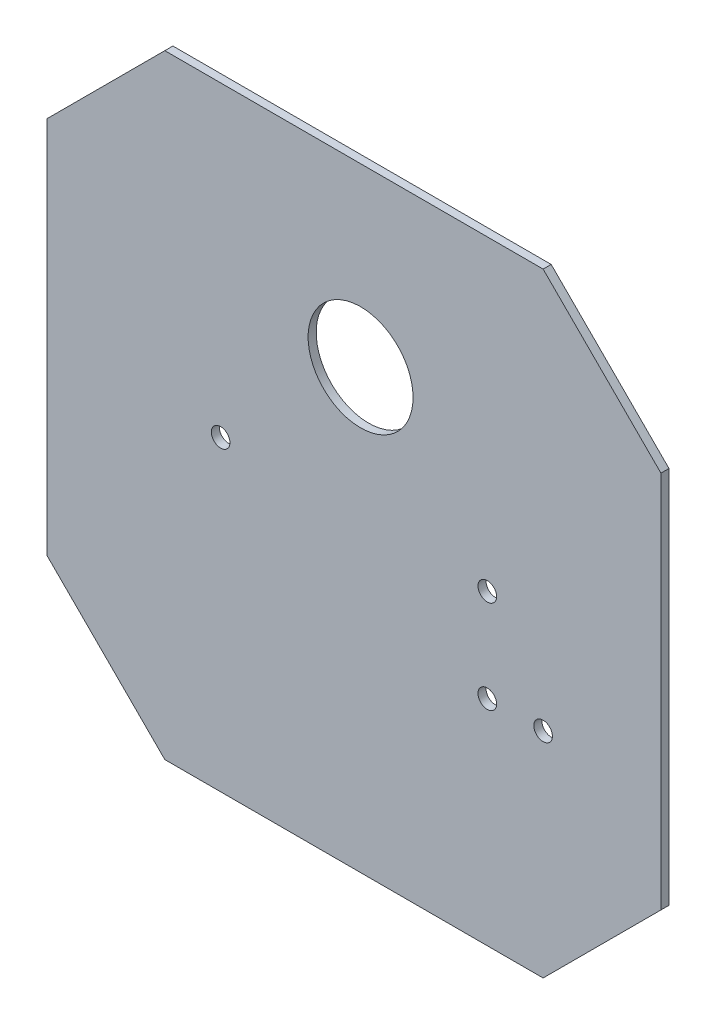
from build123d import *

# Parameters (mm, degrees)
SKETCH1_R           = 1.5
BOSS_EXTRUDE1_DEPTH = 1.3
SKETCH3_R           = 8.460587883
CUT_EXTRUDE1_DEPTH  = 20


with BuildPart() as part:
    # Sketch1 → Boss-Extrude1 (new body)
    with BuildSketch(Plane.XY):
        Polygon((-29.648967954, 62.034735519), (-29.648967954, 1.034735519), (-10.648967954, -17.965264481), (50.351032046, -17.965264481), (69.351032046, 1.034735519), (69.351032046, 62.034735519), (50.351032046, 81.034735519), (-10.648967954, 81.034735519), align=None)
        with Locations((-1.648967954, 31.534735519)):
            Circle(SKETCH1_R, mode=Mode.SUBTRACT)
        with Locations((41.351032046, 31.534735519)):
            Circle(SKETCH1_R, mode=Mode.SUBTRACT)
        with Locations((41.351032046, 16.534735519)):
            Circle(SKETCH1_R, mode=Mode.SUBTRACT)
        with Locations((50.351032046, 16.534735519)):
            Circle(SKETCH1_R, mode=Mode.SUBTRACT)
    extrude(amount=BOSS_EXTRUDE1_DEPTH)

    # Sketch3 → Cut-Extrude1 (cut)
    with BuildSketch(Plane.XY.offset(1.3)):
        with Locations((20.92010377, 52.605401567)):
            Circle(SKETCH3_R)
    extrude(amount=-CUT_EXTRUDE1_DEPTH, mode=Mode.SUBTRACT)


solid = part.part
